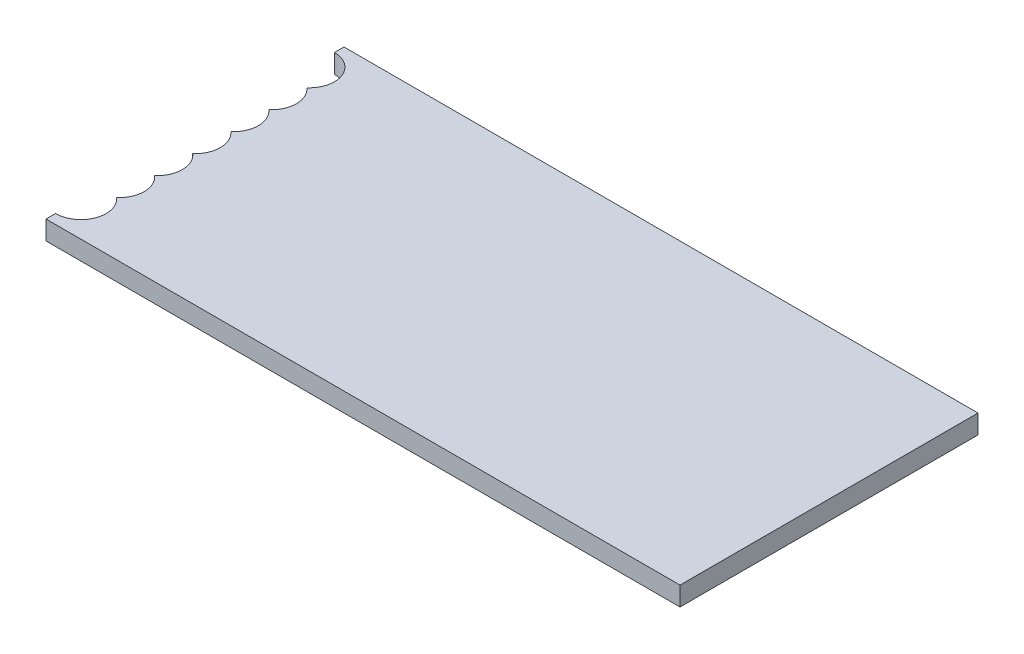
from build123d import *

# Parameters (mm, degrees)
SKETCH_1_W          = 50
SKETCH_1_H          = 23.5
EXTRUDE_1_DEPTH     = 1.5
CUT_EXTRUDE_2_DEPTH = 28.664282026


with BuildPart() as part:
    # Эскиз1 → Бобышка-Вытянуть1 (new body)
    with BuildSketch(Plane(origin=(0, 0, 0), x_dir=(1, 0, 0), z_dir=(0, 1, 0))):
        Rectangle(SKETCH_1_W, SKETCH_1_H)
    extrude(amount=EXTRUDE_1_DEPTH)

    # Эскиз2 → Вырез-Вытянуть2 (cut, through all)
    with BuildSketch(Plane(origin=(0, 1.5, 0), x_dir=(1, 0, 0), z_dir=(0, 1, 0))):
        with BuildLine():
            ThreePointArc((-25, 11), (-26.870828693, 9.707106781), (-26.322875656, 7.5))
            ThreePointArc((-26.322875656, 7.5), (-25.707106781, 7.870828693), (-25, 8))
            Line((-25, 8), (-25, 11))
        make_face()
        with BuildLine():
            ThreePointArc((-25, 8), (-25.707106781, 7.870828693), (-26.322875656, 7.5))
            ThreePointArc((-26.322875656, 7.5), (-25.707106781, 7.129171307), (-25, 7))
            Line((-25, 7), (-25, 8))
        make_face()
        with BuildLine():
            Line((-25, 8), (-25, 7))
            ThreePointArc((-25, 7), (-24.292893219, 7.129171307), (-23.677124344, 7.5))
            ThreePointArc((-23.677124344, 7.5), (-24.292893219, 7.870828693), (-25, 8))
        make_face()
        with BuildLine():
            ThreePointArc((-25, 8), (-24.292893219, 7.870828693), (-23.677124344, 7.5))
            ThreePointArc((-23.677124344, 7.5), (-23.177124344, 8.177124344), (-23, 9))
            ThreePointArc((-23, 9), (-23.585786438, 10.414213562), (-25, 11))
            Line((-25, 11), (-25, 8))
        make_face()
        with BuildLine():
            ThreePointArc((-25, 5), (-24.292893219, 4.870828693), (-23.677124344, 4.5))
            ThreePointArc((-23.677124344, 4.5), (-23.177124344, 5.177124344), (-23, 6))
            ThreePointArc((-23, 6), (-23.177124344, 6.822875656), (-23.677124344, 7.5))
            ThreePointArc((-23.677124344, 7.5), (-24.292893219, 7.129171307), (-25, 7))
            Line((-25, 7), (-25, 5))
        make_face()
        with BuildLine():
            ThreePointArc((-26.322875656, 7.5), (-27, 6), (-26.322875656, 4.5))
            ThreePointArc((-26.322875656, 4.5), (-25.707106781, 4.870828693), (-25, 5))
            Line((-25, 5), (-25, 7))
            ThreePointArc((-25, 7), (-25.707106781, 7.129171307), (-26.322875656, 7.5))
        make_face()
        with BuildLine():
            Line((-25, 5), (-25, 4))
            ThreePointArc((-25, 4), (-24.292893219, 4.129171307), (-23.677124344, 4.5))
            ThreePointArc((-23.677124344, 4.5), (-24.292893219, 4.870828693), (-25, 5))
        make_face()
        with BuildLine():
            ThreePointArc((-26.322875656, 4.5), (-25.707106781, 4.129171307), (-25, 4))
            Line((-25, 4), (-25, 5))
            ThreePointArc((-25, 5), (-25.707106781, 4.870828693), (-26.322875656, 4.5))
        make_face()
        with BuildLine():
            ThreePointArc((-25, 2), (-24.292893219, 1.870828693), (-23.677124344, 1.5))
            ThreePointArc((-23.677124344, 1.5), (-23.177124344, 2.177124344), (-23, 3))
            ThreePointArc((-23, 3), (-23.177124344, 3.822875656), (-23.677124344, 4.5))
            ThreePointArc((-23.677124344, 4.5), (-24.292893219, 4.129171307), (-25, 4))
            Line((-25, 4), (-25, 2))
        make_face()
        with BuildLine():
            ThreePointArc((-26.322875656, 1.5), (-25.707106781, 1.870828693), (-25, 2))
            Line((-25, 2), (-25, 4))
            ThreePointArc((-25, 4), (-25.707106781, 4.129171307), (-26.322875656, 4.5))
            ThreePointArc((-26.322875656, 4.5), (-27, 3), (-26.322875656, 1.5))
        make_face()
        with BuildLine():
            ThreePointArc((-25, 1), (-24.292893219, 1.129171307), (-23.677124344, 1.5))
            ThreePointArc((-23.677124344, 1.5), (-24.292893219, 1.870828693), (-25, 2))
            Line((-25, 2), (-25, 1))
        make_face()
        with BuildLine():
            Line((-25, 1), (-25, 2))
            ThreePointArc((-25, 2), (-25.707106781, 1.870828693), (-26.322875656, 1.5))
            ThreePointArc((-26.322875656, 1.5), (-25.707106781, 1.129171307), (-25, 1))
        make_face()
        with BuildLine():
            ThreePointArc((-23.677124344, -1.5), (-23.177124344, -0.822875656), (-23, 0))
            ThreePointArc((-23, 0), (-23.177124344, 0.822875656), (-23.677124344, 1.5))
            ThreePointArc((-23.677124344, 1.5), (-24.292893219, 1.129171307), (-25, 1))
            Line((-25, 1), (-25, -1))
            ThreePointArc((-25, -1), (-24.292893219, -1.129171307), (-23.677124344, -1.5))
        make_face()
        with BuildLine():
            Line((-25, -1), (-25, 1))
            ThreePointArc((-25, 1), (-25.707106781, 1.129171307), (-26.322875656, 1.5))
            ThreePointArc((-26.322875656, 1.5), (-27, 0), (-26.322875656, -1.5))
            ThreePointArc((-26.322875656, -1.5), (-25.707106781, -1.129171307), (-25, -1))
        make_face()
        with BuildLine():
            ThreePointArc((-25, -2), (-24.292893219, -1.870828693), (-23.677124344, -1.5))
            ThreePointArc((-23.677124344, -1.5), (-24.292893219, -1.129171307), (-25, -1))
            Line((-25, -1), (-25, -2))
        make_face()
        with BuildLine():
            ThreePointArc((-26.322875656, -1.5), (-25.707106781, -1.870828693), (-25, -2))
            Line((-25, -2), (-25, -1))
            ThreePointArc((-25, -1), (-25.707106781, -1.129171307), (-26.322875656, -1.5))
        make_face()
        with BuildLine():
            ThreePointArc((-23, -3), (-23.177124344, -2.177124344), (-23.677124344, -1.5))
            ThreePointArc((-23.677124344, -1.5), (-24.292893219, -1.870828693), (-25, -2))
            Line((-25, -2), (-25, -4))
            ThreePointArc((-25, -4), (-24.292893219, -4.129171307), (-23.677124344, -4.5))
            ThreePointArc((-23.677124344, -4.5), (-23.177124344, -3.822875656), (-23, -3))
        make_face()
        with BuildLine():
            Line((-25, -4), (-25, -2))
            ThreePointArc((-25, -2), (-25.707106781, -1.870828693), (-26.322875656, -1.5))
            ThreePointArc((-26.322875656, -1.5), (-27, -3), (-26.322875656, -4.5))
            ThreePointArc((-26.322875656, -4.5), (-25.707106781, -4.129171307), (-25, -4))
        make_face()
        with BuildLine():
            Line((-25, -5), (-25, -4))
            ThreePointArc((-25, -4), (-25.707106781, -4.129171307), (-26.322875656, -4.5))
            ThreePointArc((-26.322875656, -4.5), (-25.707106781, -4.870828693), (-25, -5))
        make_face()
        with BuildLine():
            ThreePointArc((-23.677124344, -4.5), (-24.292893219, -4.129171307), (-25, -4))
            Line((-25, -4), (-25, -5))
            ThreePointArc((-25, -5), (-24.292893219, -4.870828693), (-23.677124344, -4.5))
        make_face()
        with BuildLine():
            ThreePointArc((-23, -6), (-23.177124344, -5.177124344), (-23.677124344, -4.5))
            ThreePointArc((-23.677124344, -4.5), (-24.292893219, -4.870828693), (-25, -5))
            Line((-25, -5), (-25, -7))
            ThreePointArc((-25, -7), (-24.292893219, -7.129171307), (-23.677124344, -7.5))
            ThreePointArc((-23.677124344, -7.5), (-23.177124344, -6.822875656), (-23, -6))
        make_face()
        with BuildLine():
            ThreePointArc((-25, -5), (-25.707106781, -4.870828693), (-26.322875656, -4.5))
            ThreePointArc((-26.322875656, -4.5), (-27, -6), (-26.322875656, -7.5))
            ThreePointArc((-26.322875656, -7.5), (-25.707106781, -7.129171307), (-25, -7))
            Line((-25, -7), (-25, -5))
        make_face()
        with BuildLine():
            ThreePointArc((-25, -7), (-25.707106781, -7.129171307), (-26.322875656, -7.5))
            ThreePointArc((-26.322875656, -7.5), (-25.707106781, -7.870828693), (-25, -8))
            Line((-25, -8), (-25, -7))
        make_face()
        with BuildLine():
            ThreePointArc((-25, -8), (-25.707106781, -7.870828693), (-26.322875656, -7.5))
            ThreePointArc((-26.322875656, -7.5), (-26.870828693, -9.707106781), (-25, -11))
            Line((-25, -11), (-25, -8))
        make_face()
        with BuildLine():
            ThreePointArc((-23.677124344, -7.5), (-24.292893219, -7.129171307), (-25, -7))
            Line((-25, -7), (-25, -8))
            ThreePointArc((-25, -8), (-24.292893219, -7.870828693), (-23.677124344, -7.5))
        make_face()
        with BuildLine():
            ThreePointArc((-23, -9), (-23.177124344, -8.177124344), (-23.677124344, -7.5))
            ThreePointArc((-23.677124344, -7.5), (-24.292893219, -7.870828693), (-25, -8))
            Line((-25, -8), (-25, -11))
            ThreePointArc((-25, -11), (-23.585786438, -10.414213562), (-23, -9))
        make_face()
    extrude(amount=-CUT_EXTRUDE_2_DEPTH, mode=Mode.SUBTRACT)


solid = part.part
